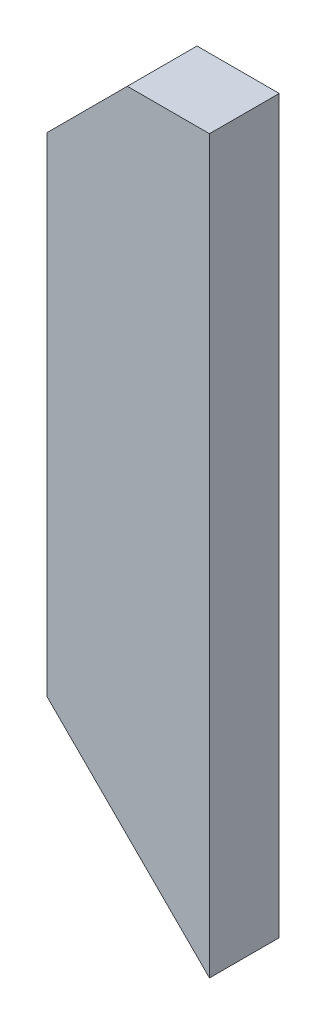
from build123d import *

# Parameters (mm, degrees)
SKETCH1_W           = 88.9
SKETCH1_H           = 38.1
BOSS_EXTRUDE1_DEPTH = 444.5
CUT_EXTRUDE1_DEPTH  = 449.338780946
CUT_EXTRUDE2_DEPTH  = 449.338780946


with BuildPart() as part:
    # Sketch1 → Boss-Extrude1 (new body)
    with BuildSketch(Plane(origin=(0, 0, 0), x_dir=(1, 0, 0), z_dir=(0, 1, 0))):
        Rectangle(SKETCH1_W, SKETCH1_H)
    extrude(amount=BOSS_EXTRUDE1_DEPTH)

    # Sketch2 → Cut-Extrude1 (cut, through all)
    with BuildSketch(Plane.XY.offset(19.05)):
        Polygon((-44.45, 444.5), (44.45, 444.5), (-44.45, 355.6), align=None)
        Polygon((44.45, 0), (-44.45, 0), (-44.45, 88.9), align=None)
    extrude(amount=-CUT_EXTRUDE1_DEPTH, mode=Mode.SUBTRACT)

    # Sketch3 → Cut-Extrude2 (cut, through all)
    with BuildSketch(Plane.XY.offset(19.05)):
        Polygon((44.45, 444.5), (-0.451280605, 399.598719395), (44.45, 399.598719395), align=None)
    extrude(amount=-CUT_EXTRUDE2_DEPTH, mode=Mode.SUBTRACT)


solid = part.part
